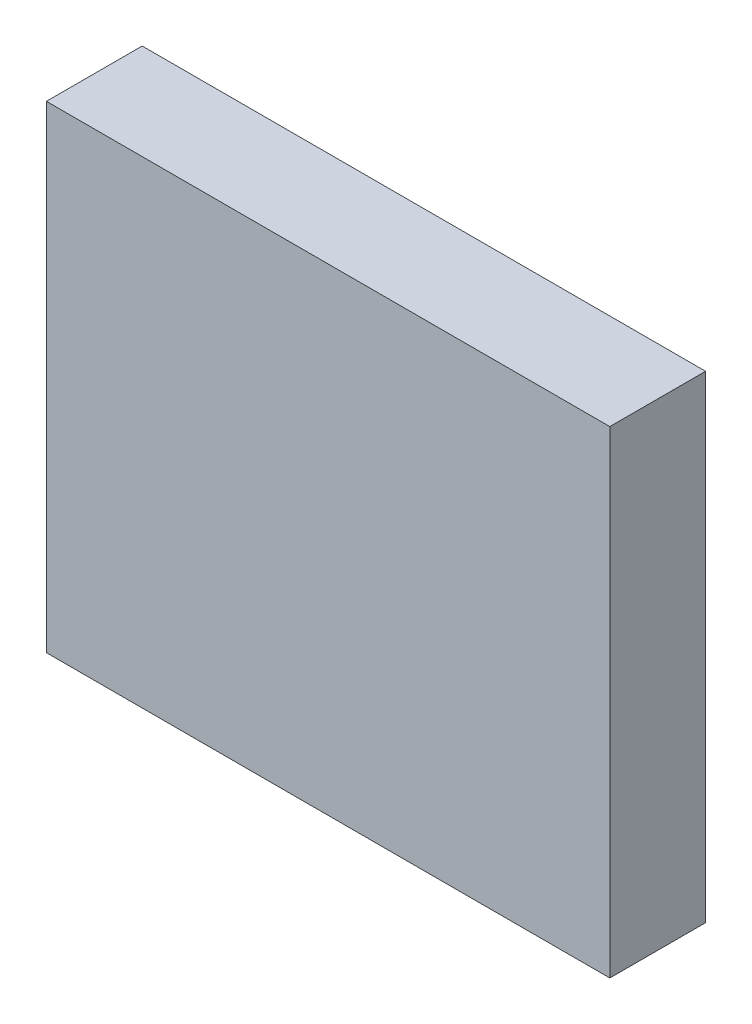
from build123d import *

# Parameters (mm, degrees)
SKETCH2_W           = 21
SKETCH2_H           = 17.8
BOSS_EXTRUDE1_DEPTH = 3.57


with BuildPart() as part:
    # Sketch2 → Boss-Extrude1 (new body)
    with BuildSketch(Plane.XY):
        Rectangle(SKETCH2_W, SKETCH2_H)
    extrude(amount=BOSS_EXTRUDE1_DEPTH)


solid = part.part
